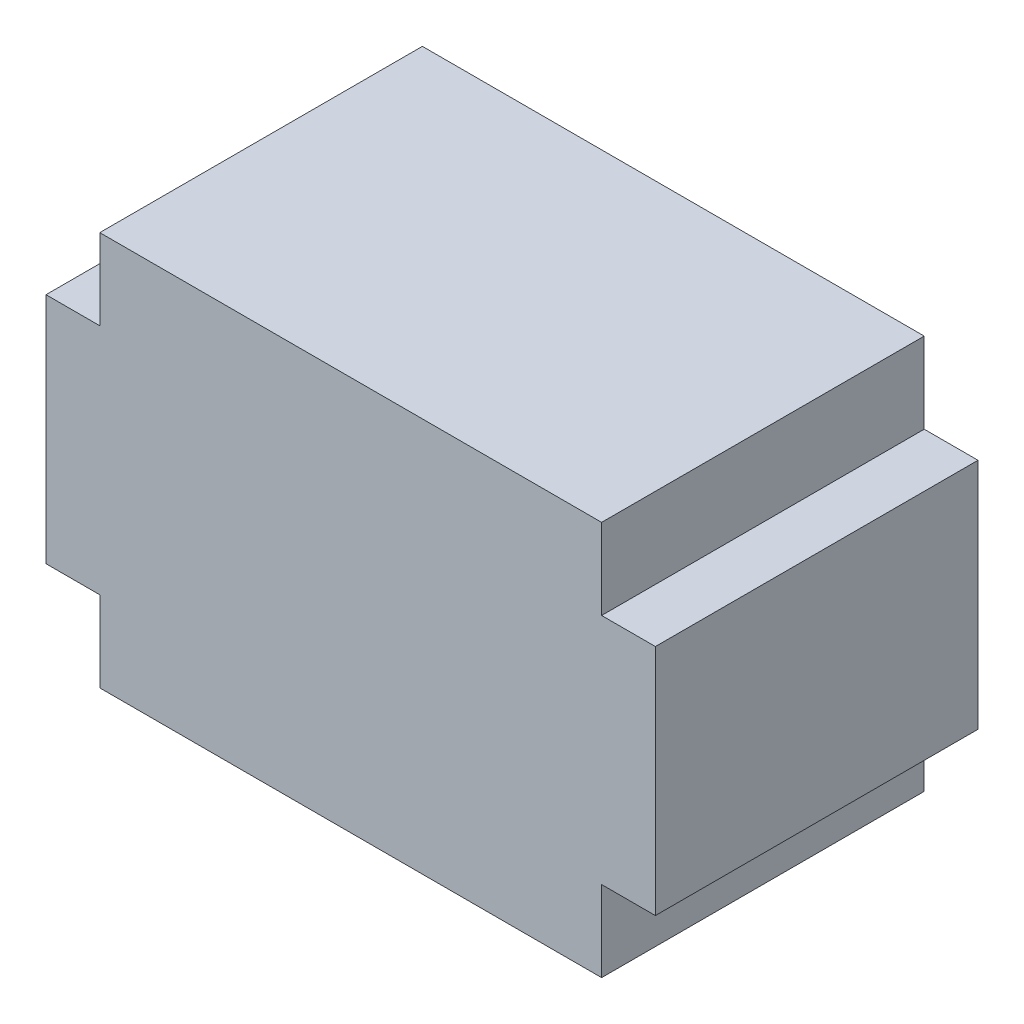
from build123d import *

# Parameters (mm, degrees)
COMPONENT_OUTLINE_DEPTH = 1.8


with BuildPart() as part:
    # 草图1 → Component_Outline (new body)
    with BuildSketch(Plane.XY):
        Polygon((-1.4, -1.1), (-1.4, -0.65), (-1.7, -0.65), (-1.7, 0.65), (-1.4, 0.65), (-1.4, 1.1), (1.4, 1.1), (1.4, 0.65), (1.7, 0.65), (1.7, -0.65), (1.4, -0.65), (1.4, -1.1), (-1.35, -1.1), align=None)
    extrude(amount=COMPONENT_OUTLINE_DEPTH)


solid = part.part
